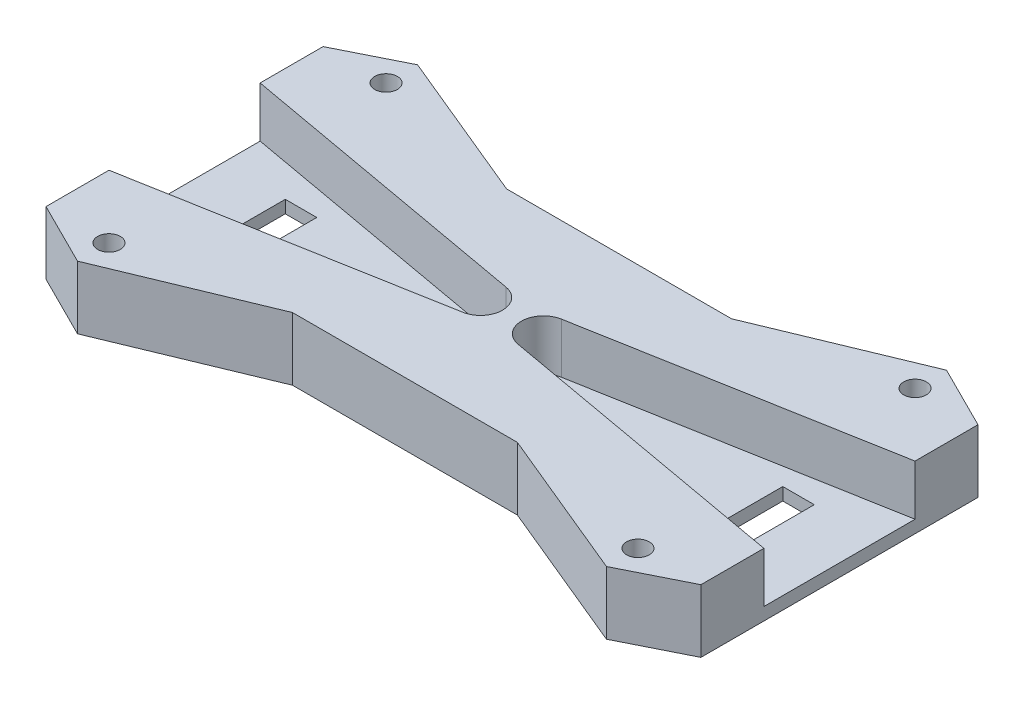
from build123d import *

# Parameters (mm, degrees)
SKETCH1_R           = 1.8
BOSS_EXTRUDE1_DEPTH = 10
SKETCH1_3_W         = 5
SKETCH1_3_H         = 12
BOSS_EXTRUDE2_DEPTH = 2


with BuildPart() as part:
    # Sketch1 → Boss-Extrude1 (new body)
    with BuildSketch(Plane(origin=(0, 0, 0), x_dir=(1, 0, 0), z_dir=(0, 1, 0))):
        with BuildLine():
            Line((-42, -27), (-17.857864376, -17))
            Line((-17.857864376, -17), (17.857864376, -17))
            Line((17.857864376, -17), (42, -27))
            Line((42, -27), (52, -22))
            Line((52, -22), (52, -12))
            Line((52, -12), (4.381103052, -3.444846378))
            ThreePointArc((4.381103052, -3.444846378), (1.5, 0), (4.381103052, 3.444846378))
            Line((4.381103052, 3.444846378), (52, 12))
            Line((52, 12), (52, 22))
            Line((52, 22), (42, 27))
            Line((42, 27), (17.857864376, 17))
            Line((17.857864376, 17), (-17.857864376, 17))
            Line((-17.857864376, 17), (-42, 27))
            Line((-42, 27), (-52, 22))
            Line((-52, 22), (-52, 12))
            Line((-52, 12), (-4.381103052, 3.444846378))
            ThreePointArc((-4.381103052, 3.444846378), (-1.5, 0), (-4.381103052, -3.444846378))
            Line((-4.381103052, -3.444846378), (-52, -12))
            Line((-52, -12), (-52, -22))
            Line((-52, -22), (-42, -27))
        make_face()
        with Locations((-42, -22)):
            Circle(SKETCH1_R, mode=Mode.SUBTRACT)
        with Locations((-42, 22)):
            Circle(SKETCH1_R, mode=Mode.SUBTRACT)
        with Locations((42, 22)):
            Circle(SKETCH1_R, mode=Mode.SUBTRACT)
        with Locations((42, -22)):
            Circle(SKETCH1_R, mode=Mode.SUBTRACT)
    extrude(amount=BOSS_EXTRUDE1_DEPTH)

    # Sketch1<3> → Boss-Extrude2 (add)
    # profile 1 of 2: a face of its own
    with BuildSketch(Plane(origin=(0, 0, 0), x_dir=(1, 0, 0), z_dir=(0, 1, 0))):
        with BuildLine():
            Line((-52, 12), (-52, -12))
            Line((-52, -12), (-4.381103052, -3.444846378))
            ThreePointArc((-4.381103052, -3.444846378), (-1.5, 0), (-4.381103052, 3.444846378))
            Line((-4.381103052, 3.444846378), (-52, 12))
        make_face()
        with Locations((-39.5, 0)):
            Rectangle(SKETCH1_3_W, SKETCH1_3_H, mode=Mode.SUBTRACT)
    # profile 2 of 2: a face of its own
    with BuildSketch(Plane(origin=(0, 0, 0), x_dir=(1, 0, 0), z_dir=(0, 1, 0))):
        with BuildLine():
            Line((4.381103052, -3.444846378), (52, -12))
            Line((52, -12), (52, 12))
            Line((52, 12), (4.381103052, 3.444846378))
            ThreePointArc((4.381103052, 3.444846378), (1.5, 0), (4.381103052, -3.444846378))
        make_face()
        with Locations((39.5, 0)):
            Rectangle(SKETCH1_3_W, SKETCH1_3_H, mode=Mode.SUBTRACT)
    extrude(amount=BOSS_EXTRUDE2_DEPTH)


solid = part.part
